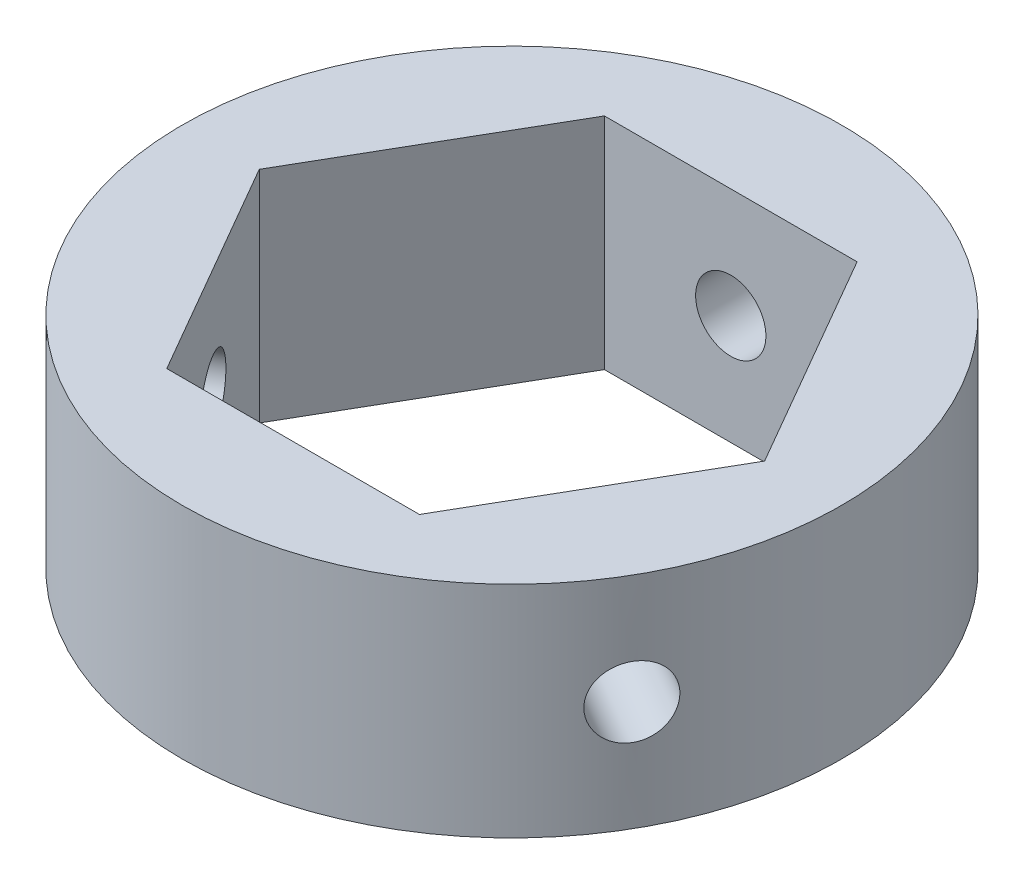
from build123d import *

# Parameters (mm, degrees)
SKETCH1_R           = 15
BOSS_EXTRUDE1_DEPTH = 10
CUT_EXTRUDE1_DEPTH  = 24.452078799
SKETCH4_R           = 1.6
CUT_EXTRUDE2_DEPTH  = 10
CIRPATTERN2_COUNT   = 3


with BuildPart() as part:
    # Sketch1 → Boss-Extrude1 (new body)
    with BuildSketch(Plane(origin=(0, 0, 0), x_dir=(1, 0, 0), z_dir=(0, 1, 0))):
        with Locations(Location((0, 0, 0), (0, 0, 270))):
            Circle(SKETCH1_R)
    extrude(amount=BOSS_EXTRUDE1_DEPTH)

    # Sketch2 → Cut-Extrude1 (cut, through all)
    with BuildSketch(Plane(origin=(0, 10, 0), x_dir=(1, 0, 0), z_dir=(0, 1, 0))):
        Polygon((11.5, 0), (5.75, 9.959292144), (-5.75, 9.959292144), (-11.5, 0), (-5.75, -9.959292144), (5.75, -9.959292144), align=None)
    extrude(amount=-CUT_EXTRUDE1_DEPTH, mode=Mode.SUBTRACT)

    # Sketch4 → Cut-Extrude2 (cut)
    with BuildSketch(Plane(origin=(-12.990381057, 0, 7.5), x_dir=(0.5000000000000002, 0, 0.8660254037844386), z_dir=(-0.8660254037844385, 0, 0.5000000000000001))):
        with Locations((0, 5)):
            Circle(SKETCH4_R)
    cut_extrude2 = extrude(amount=-CUT_EXTRUDE2_DEPTH, mode=Mode.SUBTRACT)

    # CirPattern2: Cut-Extrude2 ×3 about axis
    cirpattern2_axis = Axis((0, 10, 0), (0, -1, 0))
    for i in range(1, CIRPATTERN2_COUNT):
        add(cut_extrude2.rotate(cirpattern2_axis, i * 360 / CIRPATTERN2_COUNT), mode=Mode.SUBTRACT)


solid = part.part
